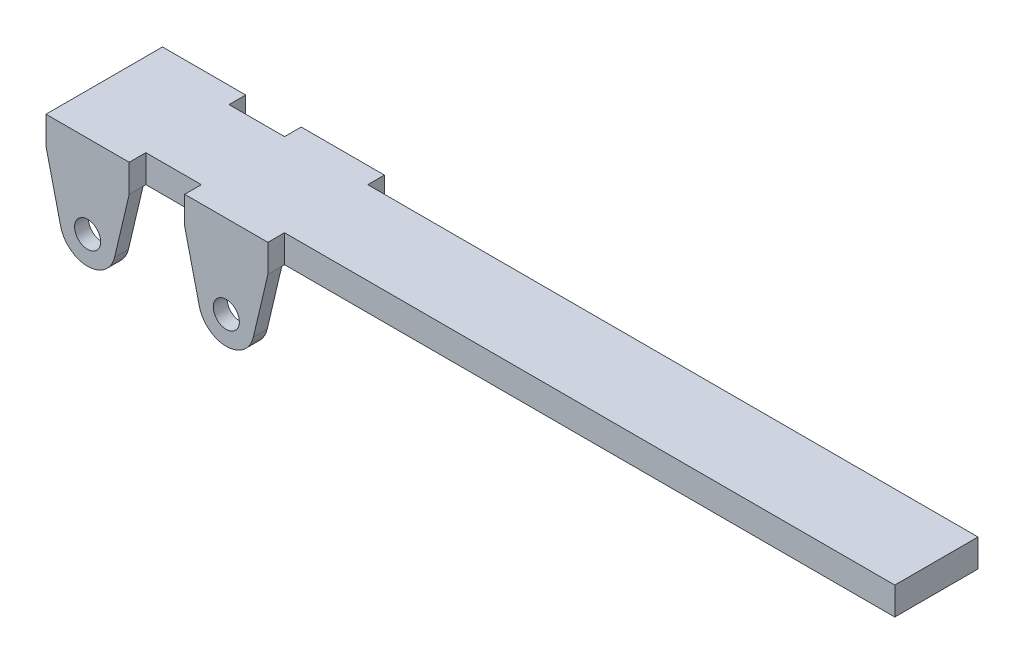
from build123d import *

# Parameters (mm, degrees)
SKETCH_1_W               = 150
SKETCH_1_H               = 5
EXTRUDE_1_DEPTH          = 15
SKETCH_2_W               = 15
SKETCH_2_H               = 5
SKETCH_2_R               = 2.35
EXTRUDE_2_DEPTH          = 3
MIRROR_2_COPY_1_SKETCH_W = 15
MIRROR_2_COPY_1_SKETCH_H = 5
MIRROR_2_COPY_1_SKETCH_R = 2.35
MIRROR_2_COPY_1_DEPTH    = 3
SKETCH_3_W               = 16
SKETCH_3_H               = 20
CUT_EXTRUDE_1_DEPTH      = 53


with BuildPart() as part:
    # 草图1 → 凸台-拉伸1 (new body)
    with BuildSketch(Plane.XY):
        with Locations((75, 2.5)):
            Rectangle(SKETCH_1_W, SKETCH_1_H)
    extrude(amount=EXTRUDE_1_DEPTH)

    # 草图2 → 凸台-拉伸2 (add)
    # profile 1 of 4: a face of its own
    with BuildSketch(Plane.XY.offset(15)):
        with Locations((7.5, 2.5)):
            Rectangle(SKETCH_2_W, SKETCH_2_H)
    # profile 2 of 4: a face of its own
    with BuildSketch(Plane.XY.offset(15)):
        with BuildLine():
            Line((15, 0), (0, 0))
            Line((0, 0), (2.633939444, -11.149545417))
            ThreePointArc((2.633939444, -11.149545417), (6.921338951, -5.033597742), (12.5, -10))
            ThreePointArc((12.5, -10), (12.466402258, -10.578661049), (12.366060556, -11.149545417))
            Line((12.366060556, -11.149545417), (15, 0))
        make_face()
    # profile 3 of 4: a face of its own
    with BuildSketch(Plane.XY.offset(15)):
        with BuildLine():
            ThreePointArc((12.5, -10), (6.921338951, -5.033597742), (2.633939444, -11.149545417))
            ThreePointArc((2.633939444, -11.149545417), (7.5, -15), (12.366060556, -11.149545417))
            ThreePointArc((12.366060556, -11.149545417), (12.466402258, -10.578661049), (12.5, -10))
        make_face()
        with Locations((7.5, -10)):
            Circle(SKETCH_2_R, mode=Mode.SUBTRACT)
    # profile 4 of 4: a face of its own
    with BuildSketch(Plane.XY.offset(15)):
        with BuildLine():
            ThreePointArc((12.5, -10), (6.921338951, -5.033597742), (2.633939444, -11.149545417))
            ThreePointArc((2.633939444, -11.149545417), (7.5, -15), (12.366060556, -11.149545417))
            ThreePointArc((12.366060556, -11.149545417), (12.466402258, -10.578661049), (12.5, -10))
        make_face()
        with Locations((7.5, -10)):
            Circle(SKETCH_2_R, mode=Mode.SUBTRACT)
    extrude_2 = extrude(amount=EXTRUDE_2_DEPTH)

    # 镜向1: 凸台-拉伸2 across plane
    add(extrude_2.mirror(Plane(origin=(0, 0, 7.5), x_dir=(1, 0, 0), z_dir=(0, 0, -1))))

    # 镜向2: 凸台-拉伸2 across plane
    add(extrude_2.mirror(Plane.ZY.offset(-20)))

    # 镜向2 copy 1 sketch → 镜向2 copy 1 (add)
    # profile 1 of 4: a face of its own
    with BuildSketch(Plane(origin=(40, 0, 0), x_dir=(-1, 0, 0), z_dir=(0, 0, -1))):
        with Locations((7.5, 2.5)):
            Rectangle(MIRROR_2_COPY_1_SKETCH_W, MIRROR_2_COPY_1_SKETCH_H)
    # profile 2 of 4: a face of its own
    with BuildSketch(Plane(origin=(40, 0, 0), x_dir=(-1, 0, 0), z_dir=(0, 0, -1))):
        with BuildLine():
            Line((15, 0), (0, 0))
            Line((0, 0), (2.633939444, -11.149545417))
            ThreePointArc((2.633939444, -11.149545417), (6.921338951, -5.033597742), (12.5, -10))
            ThreePointArc((12.5, -10), (12.466402258, -10.578661049), (12.366060556, -11.149545417))
            Line((12.366060556, -11.149545417), (15, 0))
        make_face()
    # profile 3 of 4: a face of its own
    with BuildSketch(Plane(origin=(40, 0, 0), x_dir=(-1, 0, 0), z_dir=(0, 0, -1))):
        with BuildLine():
            ThreePointArc((12.5, -10), (6.921338951, -5.033597742), (2.633939444, -11.149545417))
            ThreePointArc((2.633939444, -11.149545417), (7.5, -15), (12.366060556, -11.149545417))
            ThreePointArc((12.366060556, -11.149545417), (12.466402258, -10.578661049), (12.5, -10))
        make_face()
        with Locations((7.5, -10)):
            Circle(MIRROR_2_COPY_1_SKETCH_R, mode=Mode.SUBTRACT)
    # profile 4 of 4: a face of its own
    with BuildSketch(Plane(origin=(40, 0, 0), x_dir=(-1, 0, 0), z_dir=(0, 0, -1))):
        with BuildLine():
            ThreePointArc((12.5, -10), (6.921338951, -5.033597742), (2.633939444, -11.149545417))
            ThreePointArc((2.633939444, -11.149545417), (7.5, -15), (12.366060556, -11.149545417))
            ThreePointArc((12.366060556, -11.149545417), (12.466402258, -10.578661049), (12.5, -10))
        make_face()
        with Locations((7.5, -10)):
            Circle(MIRROR_2_COPY_1_SKETCH_R, mode=Mode.SUBTRACT)
    extrude(amount=MIRROR_2_COPY_1_DEPTH)

    # 草图3 → 切除-拉伸1 (cut)
    with BuildSketch(Plane.ZY):
        with Locations((7.5, -10)):
            Rectangle(SKETCH_3_W, SKETCH_3_H)
    extrude(amount=-CUT_EXTRUDE_1_DEPTH, mode=Mode.SUBTRACT)


solid = part.part
